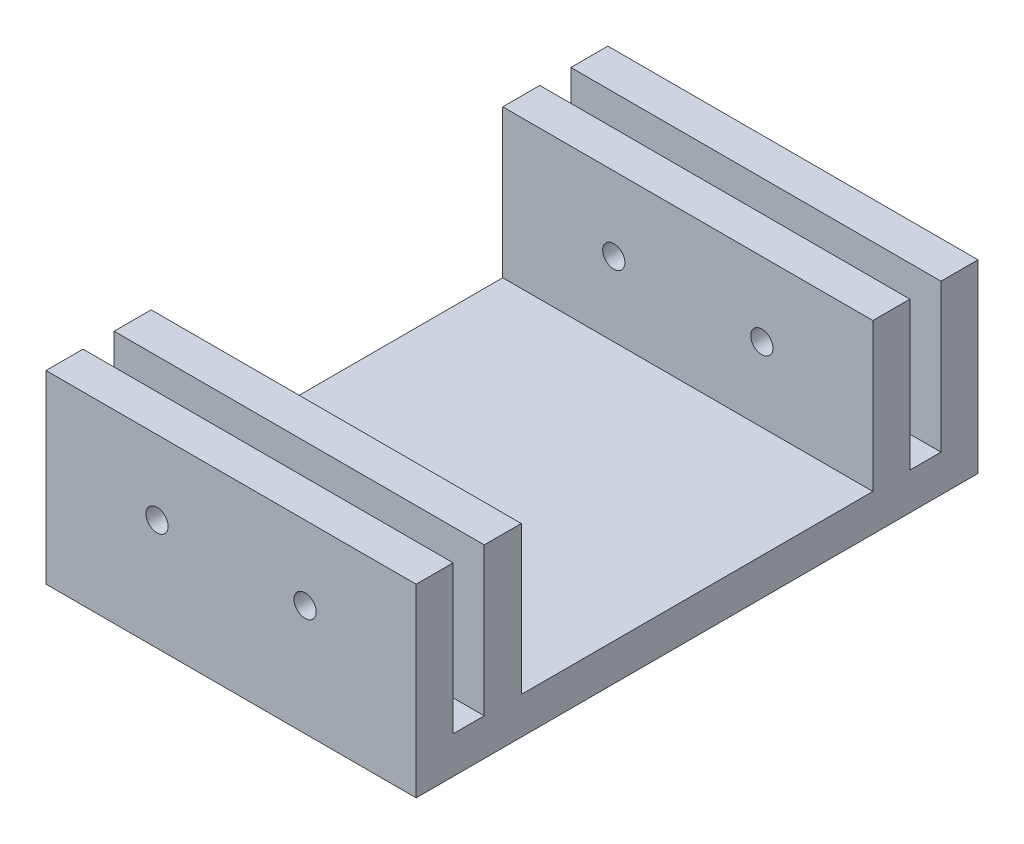
from build123d import *

# Parameters (mm, degrees)
SALIENTE_EXTRUIR2_DEPTH = 50
CROQUIS4_R              = 1.5
CORTAR_EXTRUIR2_DEPTH   = 95


with BuildPart() as part:
    # Croquis2 → Saliente-Extruir2 (new body)
    with BuildSketch(Plane(origin=(0, 0, 0), x_dir=(0, 0, -1), z_dir=(1, 0, 0))):
        Polygon((-34.418181818, 2.5), (-34.418181818, 22.5), (-29.418181818, 22.5), (-29.418181818, 2.5), (-25.218181818, 2.5), (-25.218181818, 22.5), (-20.218181818, 22.5), (-20.218181818, 2.5), (27.281818182, 2.5), (27.281818182, 22.5), (32.281818182, 22.5), (32.281818182, 2.5), (36.481818182, 2.5), (36.481818182, 22.5), (41.481818182, 22.5), (41.481818182, 2.5), (41.481818182, -2.5), (-34.418181818, -2.5), align=None)
    extrude(amount=SALIENTE_EXTRUIR2_DEPTH)

    # Croquis4 → Cortar-Extruir2 (cut)
    with BuildSketch(Plane.XY.offset(34.418181818)):
        with Locations(Location((15, 12.5, 0), (0, 0, 270))):
            Circle(CROQUIS4_R)
        with Locations(Location((35, 12.5, 0), (0, 0, 270))):
            Circle(CROQUIS4_R)
    extrude(amount=-CORTAR_EXTRUIR2_DEPTH, mode=Mode.SUBTRACT)


solid = part.part
